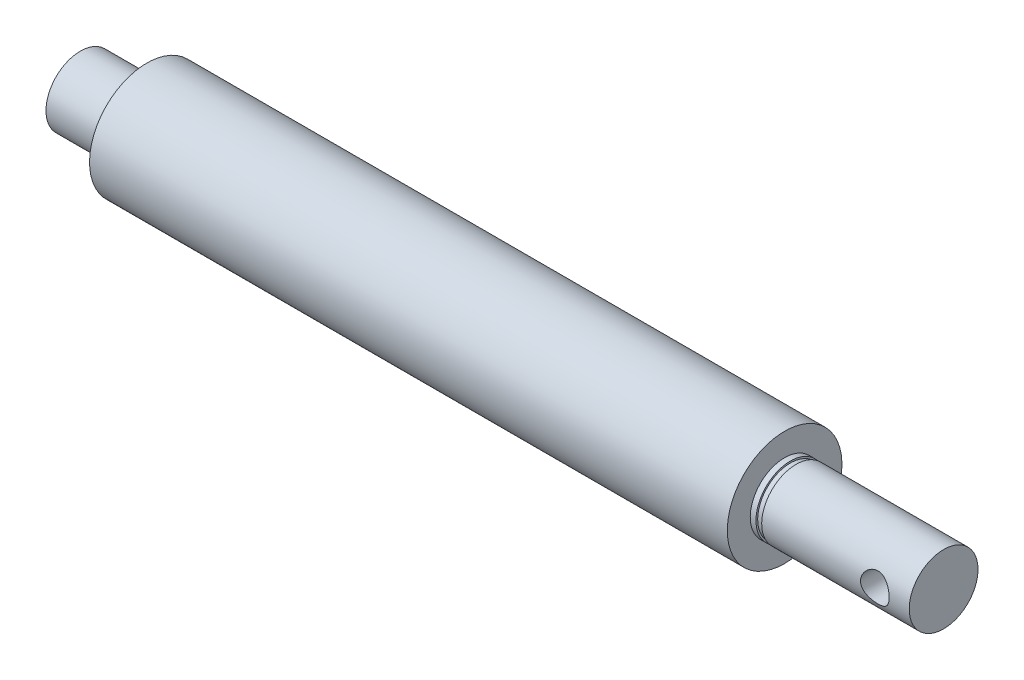
from build123d import *

# Parameters (mm, degrees)
SKETCH4_R          = 1.25
CUT_EXTRUDE1_DEPTH = 5


with BuildPart() as part:
    # Sketch1 → Revolve1 (revolve)
    with BuildSketch(Plane.XY, mode=Mode.PRIVATE) as revolve1_sk:
        Polygon((0, 0), (75.3, 0), (75.3, 3), (62.43, 3), (62.43, 2.85), (61.93, 2.85), (61.93, 3), (61.43, 3), (61.43, 5), (5.8, 5), (5.8, 3), (5.3, 3), (5.3, 2.85), (4.8, 2.85), (4.8, 3), (0, 3), align=None)
    revolve(revolve1_sk.sketch.rotate(Axis((0, 0, 0), (1, 0, 0)), 180), axis=Axis((0, 0, 0), (1, 0, 0)))

    # Sketch4 → Cut-Extrude1 (cut, symmetric)
    with BuildSketch(Plane(origin=(0, 0, 0), x_dir=(-1, 0, 0), z_dir=(0, 0, -1))):
        with Locations((-72.3, 0)):
            Circle(SKETCH4_R)
    extrude(amount=CUT_EXTRUDE1_DEPTH, both=True, mode=Mode.SUBTRACT)


solid = part.part
